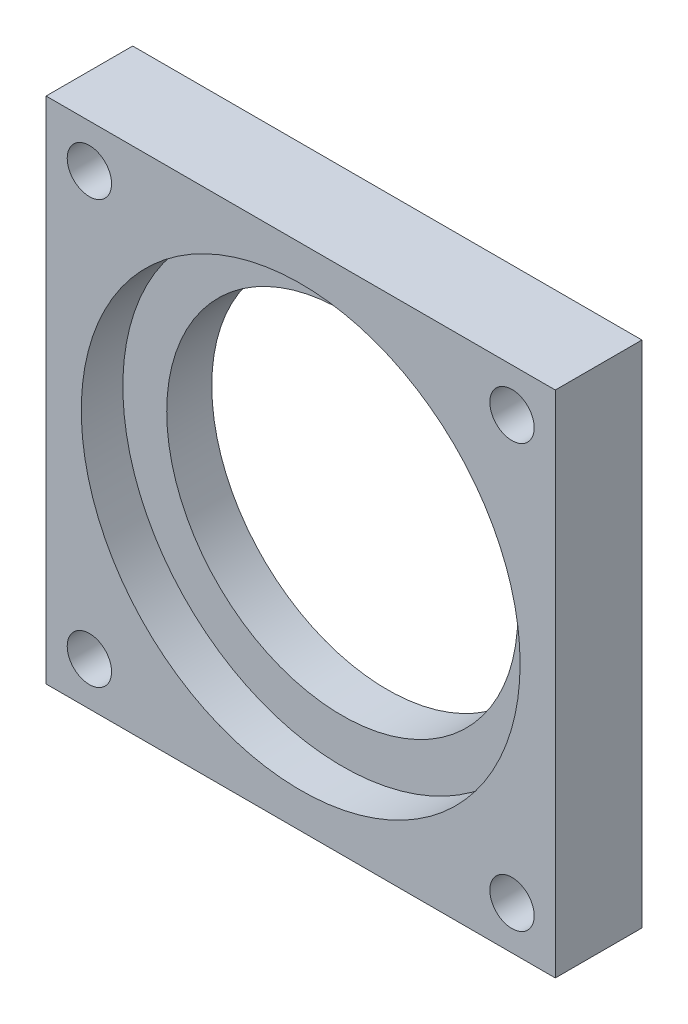
from build123d import *

# Parameters (mm, degrees)
SKETCH1_W                                      = 27.99999988
SKETCH1_H                                      = 28
BOSS_EXTRUDE1_DEPTH                            = 4.7625
SKETCH2_R                                      = 12.065
CUT_EXTRUDE1_DEPTH                             = 2.286
SKETCH3_R                                      = 9.652
CUT_EXTRUDE2_DEPTH                             = 20.953271676
CSK_FOR_2_FLAT_HEAD_MACHINE_SCREW1_D           = 2.4384
CSK_FOR_2_FLAT_HEAD_MACHINE_SCREW1_CSINK_D     = 4.3688
CSK_FOR_2_FLAT_HEAD_MACHINE_SCREW1_CSINK_ANGLE = 82


with BuildPart() as part:
    # Sketch1 → Boss-Extrude1 (new body)
    with BuildSketch(Plane.XY):
        Rectangle(SKETCH1_W, SKETCH1_H)
    extrude(amount=BOSS_EXTRUDE1_DEPTH)

    # Sketch2 → Cut-Extrude1 (cut)
    with BuildSketch(Plane.XY.offset(4.7625)):
        Circle(SKETCH2_R)
    extrude(amount=-CUT_EXTRUDE1_DEPTH, mode=Mode.SUBTRACT)

    # Sketch3 → Cut-Extrude2 (cut, through all)
    with BuildSketch(Plane.XY.offset(2.4765)):
        Circle(SKETCH3_R)
    extrude(amount=-CUT_EXTRUDE2_DEPTH, mode=Mode.SUBTRACT)

    # CSK for #2 Flat Head Machine Screw1 (through all)
    with Locations(Plane(origin=(0, 0, 0), x_dir=(-1, 0, 0), z_dir=(0, 0, -1))):
        with Locations((11.61874994, 11.61875), (11.61874994, -11.61875), (-11.61874994, -11.61875), (-11.61874994, 11.61875)):
            CounterSinkHole(CSK_FOR_2_FLAT_HEAD_MACHINE_SCREW1_D / 2, CSK_FOR_2_FLAT_HEAD_MACHINE_SCREW1_CSINK_D / 2, counter_sink_angle=CSK_FOR_2_FLAT_HEAD_MACHINE_SCREW1_CSINK_ANGLE)


solid = part.part
